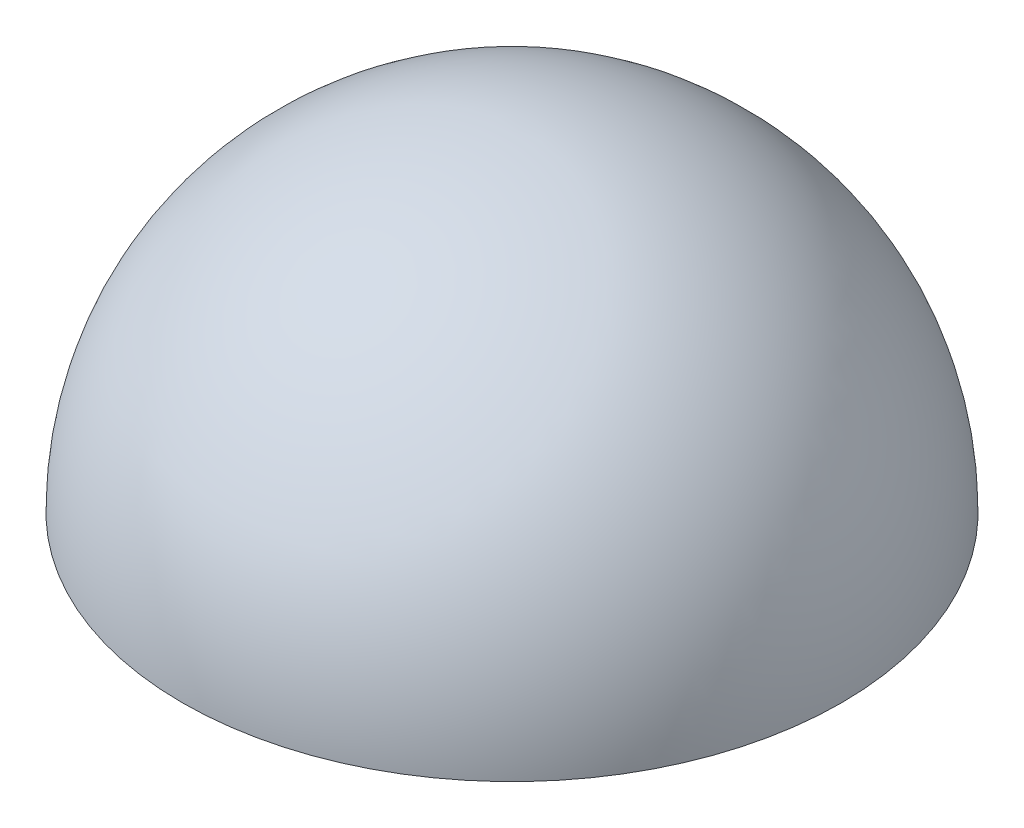
from build123d import *

# Parameters (mm, degrees)
SKETCH1_R           = 12.4
BOSS_EXTRUDE1_DEPTH = 5


with BuildPart() as part:
    # Sketch1 → Boss-Extrude1 (new body)
    with BuildSketch(Plane(origin=(0, 0, 0), x_dir=(1, 0, 0), z_dir=(0, 1, 0))):
        with Locations(Location((0, 0, 0), (0, 0, 270))):
            Circle(SKETCH1_R)
    extrude(amount=BOSS_EXTRUDE1_DEPTH)

    # Sketch2 → Revolve1 (revolve)
    with BuildSketch(Plane.XY):
        with BuildLine():
            Line((0, 5), (0, 55))
            ThreePointArc((0, 55), (35.355339059, 40.355339059), (50, 5))
            Line((50, 5), (0, 5))
        make_face()
    revolve(axis=Axis((0, 42.926192275, 0), (0, -1, 0)))


solid = part.part
